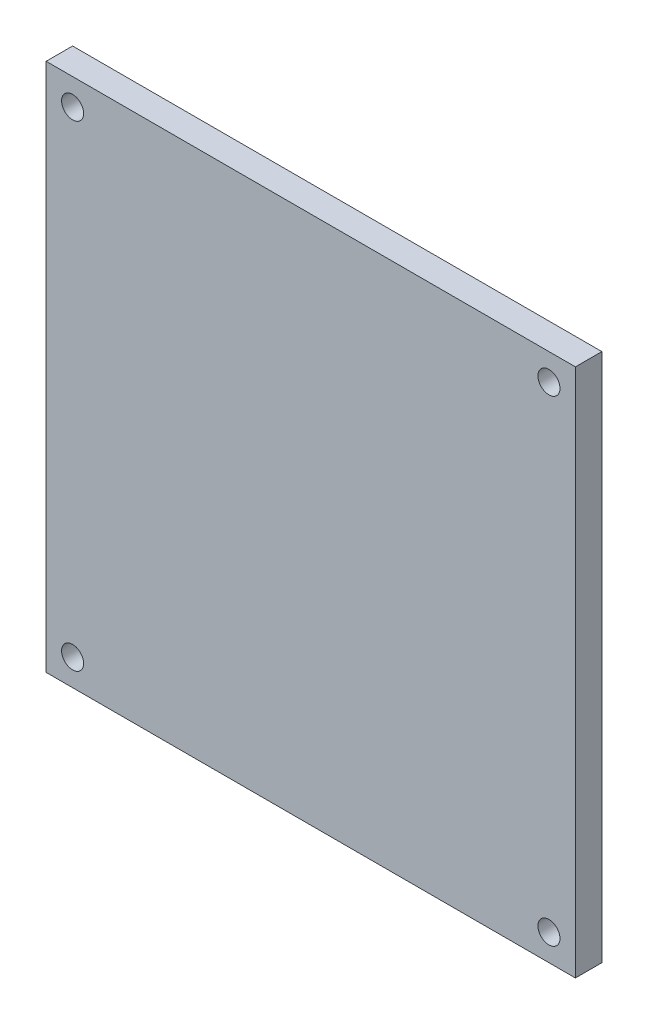
from build123d import *

# Parameters (mm, degrees)
SKETCH1_W                  = 60
SKETCH1_H                  = 60
BOSS_EXTRUDE1_DEPTH        = 3
F_2_5_2_5_DIAMETER_HOLE1_D = 2.5


with BuildPart() as part:
    # Sketch1 → Boss-Extrude1 (new body)
    with BuildSketch(Plane(origin=(0, 0, -7), x_dir=(-1, 0, 0), z_dir=(0, 0, -1))):
        Rectangle(SKETCH1_W, SKETCH1_H)
    extrude(amount=-BOSS_EXTRUDE1_DEPTH)

    # Ø2.5 (2.5) Diameter Hole1 (through all)
    with Locations(Plane.XY.offset(-4)):
        with Locations((-27, 27), (-27, -27), (27, -27), (27, 27)):
            Hole(F_2_5_2_5_DIAMETER_HOLE1_D / 2)


solid = part.part
